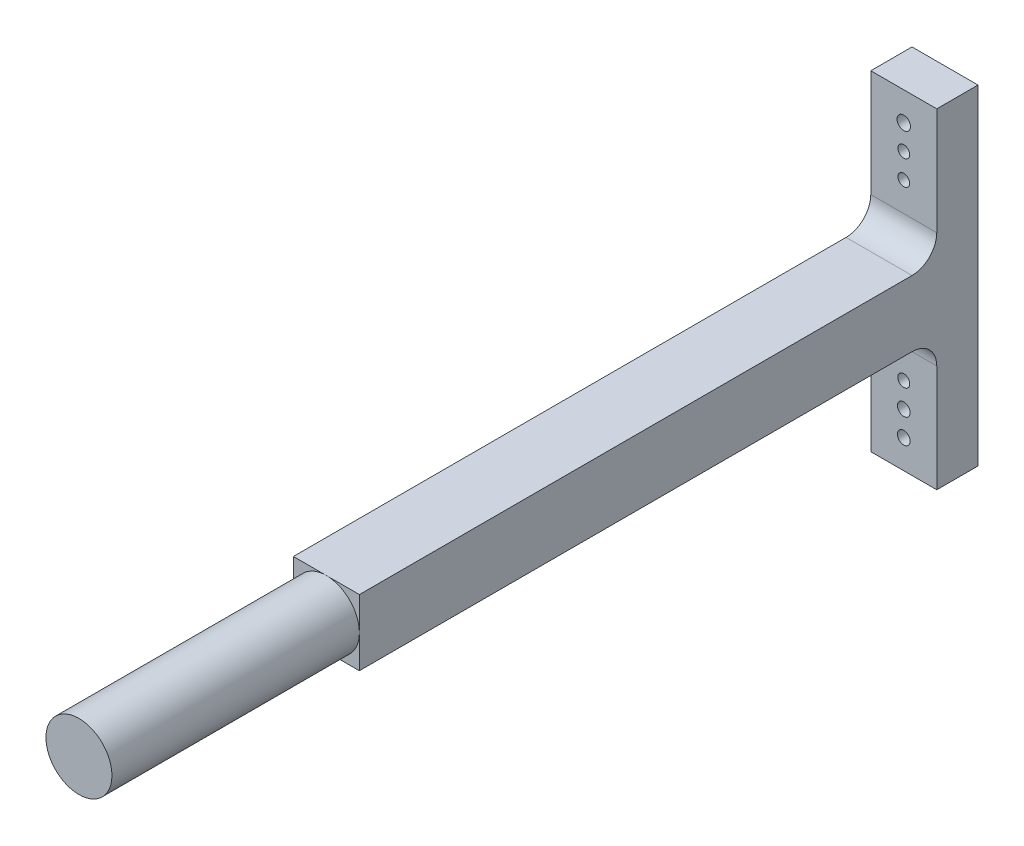
from build123d import *

# Parameters (mm, degrees)
SKETCH1_W           = 8
SKETCH1_H           = 40
BOSS_EXTRUDE1_DEPTH = 5
SKETCH3_W           = 8
SKETCH3_H           = 8
BOSS_EXTRUDE3_DEPTH = 70
SKETCH4_R           = 4
BOSS_EXTRUDE4_DEPTH = 30
SKETCH5_R           = 0.773565548
SKETCH5_R_2         = 0.768304054
SKETCH5_R_3         = 0.726526648
SKETCH5_R_4         = 0.707209462
SKETCH5_R_5         = 0.715862797
SKETCH5_R_6         = 0.812614346
CUT_EXTRUDE1_DEPTH  = 10
FILLET1_R           = 3


with BuildPart() as part:
    # Sketch1 → Boss-Extrude1 (new body)
    with BuildSketch(Plane.XY):
        with Locations((4, 20)):
            Rectangle(SKETCH1_W, SKETCH1_H)
    extrude(amount=BOSS_EXTRUDE1_DEPTH)

    # Sketch3 → Boss-Extrude3 (add)
    with BuildSketch(Plane.XY.offset(5)):
        with Locations((4, 20)):
            Rectangle(SKETCH3_W, SKETCH3_H)
    extrude(amount=BOSS_EXTRUDE3_DEPTH)

    # Sketch4 → Boss-Extrude4 (add)
    with BuildSketch(Plane.XY.offset(75)):
        with Locations((4, 20)):
            Circle(SKETCH4_R)
    extrude(amount=BOSS_EXTRUDE4_DEPTH)

    # Sketch5 → Cut-Extrude1 (cut)
    with BuildSketch(Plane.XY.offset(5)):
        with Locations((4, 3.47)):
            Circle(SKETCH5_R)
        with Locations((4, 6.47)):
            Circle(SKETCH5_R_2)
        with Locations((4, 9.47)):
            Circle(SKETCH5_R_3)
        with Locations((4, 30.53)):
            Circle(SKETCH5_R_4)
        with Locations((4, 33.53)):
            Circle(SKETCH5_R_5)
        with Locations((4, 36.53)):
            Circle(SKETCH5_R_6)
    extrude(amount=-CUT_EXTRUDE1_DEPTH, mode=Mode.SUBTRACT)

    # Fillet1
    fillet1_edges = [part.edges().sort_by_distance(p)[0] for p in [
        (4, 16, 5),
        (4, 24, 5),
    ]]
    fillet(fillet1_edges, radius=FILLET1_R)


solid = part.part
